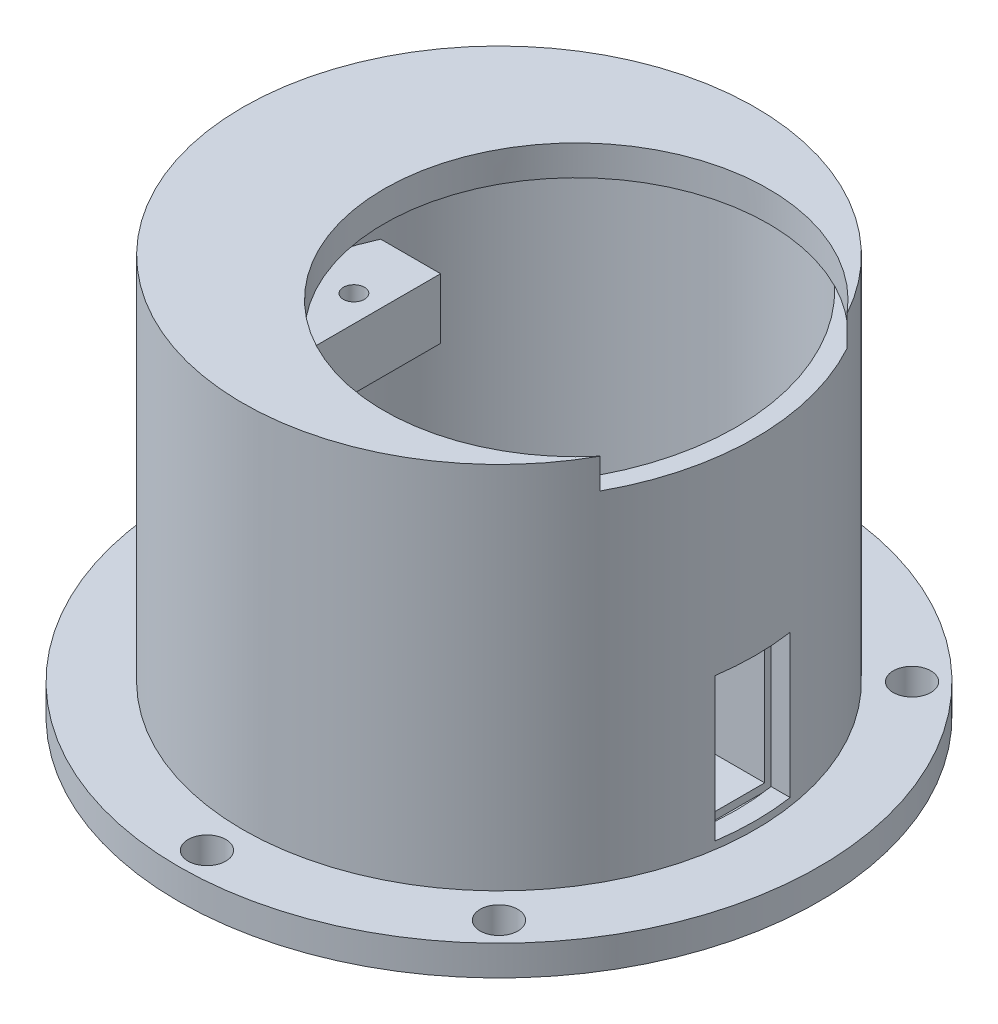
from build123d import *
from build123d.topology import SkipClean

# Parameters (mm, degrees)
SKETCH1_R           = 42.5
SKETCH1_R_2         = 30
BOSS_EXTRUDE1_DEPTH = 4
SKETCH2_R           = 34
SKETCH2_R_2         = 31.5
BOSS_EXTRUDE2_DEPTH = 45
SKETCH3_W           = 8
SKETCH3_H           = 34
SKETCH3_W_2         = 10.5
SKETCH3_H_2         = 8
BOSS_EXTRUDE3_DEPTH = 13
SKETCH4_W           = 10
SKETCH4_H           = 19
CUT_EXTRUDE1_DEPTH  = 92.650490997
SKETCH6_R           = 1.4
CUT_EXTRUDE3_DEPTH  = 7.2
SKETCH8_R           = 2.5
CUT_EXTRUDE4_DEPTH  = 4
BOSS_EXTRUDE4_DEPTH = 4


with BuildPart() as part:
    # Sketch1 → Boss-Extrude1 (new body)
    with BuildSketch(Plane(origin=(0, 0, 0), x_dir=(1, 0, 0), z_dir=(0, 1, 0))):
        with Locations(Location((0, 0, 0), (0, 0, 270))):
            Circle(SKETCH1_R)
        with Locations(Location((0, 0, 0), (0, 0, 270))):
            Circle(SKETCH1_R_2, mode=Mode.SUBTRACT)
    extrude(amount=BOSS_EXTRUDE1_DEPTH)

    # Sketch2 → Boss-Extrude2 (add)
    with BuildSketch(Plane(origin=(0, 4, 0), x_dir=(1, 0, 0), z_dir=(0, 1, 0))):
        with Locations(Location((0, 0, 0), (0, 0, 90))):
            Circle(SKETCH2_R)
        with Locations(Location((0, 0, 0), (0, 0, 90))):
            Circle(SKETCH2_R_2, mode=Mode.SUBTRACT)
    extrude(amount=BOSS_EXTRUDE2_DEPTH)

    # Sketch3 → Boss-Extrude3 (add, symmetric)
    with BuildSketch(Plane.XY):
        with Locations((26.25, 17)):
            Rectangle(SKETCH3_W, SKETCH3_H)
        with Locations((-26, 30)):
            Rectangle(SKETCH3_W_2, SKETCH3_H_2)
    extrude(amount=BOSS_EXTRUDE3_DEPTH, both=True)

    # Sketch4 → Cut-Extrude1 (cut, through all)
    with BuildSketch(Plane.ZY.offset(-22.25)):
        with Locations((0, 14.5)):
            Rectangle(SKETCH4_W, SKETCH4_H)
    extrude(amount=-CUT_EXTRUDE1_DEPTH, mode=Mode.SUBTRACT)

    # Sketch6 → Cut-Extrude3 (cut)
    with BuildSketch(Plane(origin=(0, 34, 0), x_dir=(1, 0, 0), z_dir=(0, 1, 0))):
        with Locations(Location((-24.25, -5, 0), (0, 0, 270))):
            Circle(SKETCH6_R)
        with Locations(Location((24.75, -5, 0), (0, 0, 270))):
            Circle(SKETCH6_R)
        with Locations(Location((24.75, 5, 0), (0, 0, 90))):
            Circle(SKETCH6_R)
        with Locations(Location((-24.25, 5, 0), (0, 0, 90))):
            Circle(SKETCH6_R)
    extrude(amount=-CUT_EXTRUDE3_DEPTH, mode=Mode.SUBTRACT)

    # Sketch8 → Cut-Extrude4 (cut)
    with BuildSketch(Plane(origin=(0, 4, 0), x_dir=(1, 0, 0), z_dir=(0, 1, 0))):
        with Locations(Location((-38.75, 0, 0), (0, 0, 270))):
            Circle(SKETCH8_R)
        with Locations(Location((0, 38.75, 0), (0, 0, 270))):
            Circle(SKETCH8_R)
        with Locations(Location((0, -38.75, 0), (0, 0, 270))):
            Circle(SKETCH8_R)
        with Locations(Location((27.400387771, -27.400387771, 0), (0, 0, 270))):
            Circle(SKETCH8_R)
        with Locations(Location((27.400387771, 27.400387771, 0), (0, 0, 270))):
            Circle(SKETCH8_R)
    extrude(amount=-CUT_EXTRUDE4_DEPTH, mode=Mode.SUBTRACT)

    # Sketch9 → Boss-Extrude4 (add)
    with SkipClean():  # the faces are left unmerged after this step: merging them gives an invalid solid
        with BuildSketch(Plane(origin=(0, 49, 0), x_dir=(1, 0, 0), z_dir=(0, 1, 0))):
            with BuildLine():
                ThreePointArc((29.795731707, 16.377251663), (-15.25, 0), (29.795731707, -16.377251663))
                ThreePointArc((29.795731707, -16.377251663), (-34, 0), (29.795731707, 16.377251663))
            make_face()
        extrude(amount=BOSS_EXTRUDE4_DEPTH)


solid = part.part
